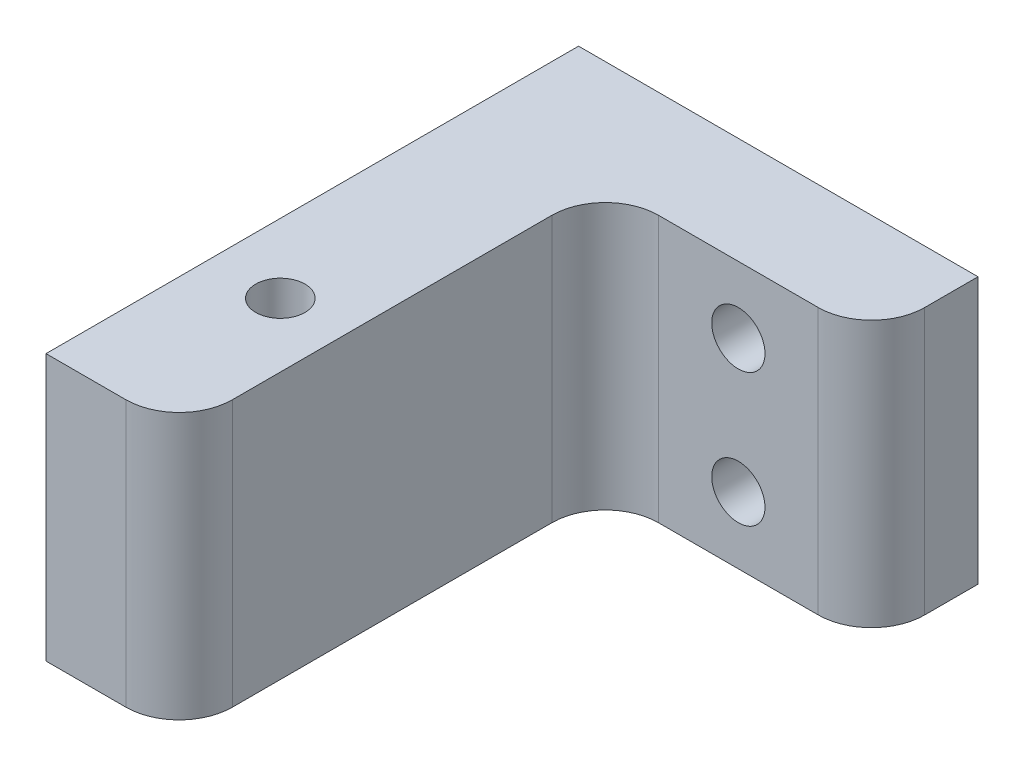
from build123d import *

# Parameters (mm, degrees)
SKETCH2_W           = 12.4
SKETCH2_H           = 10
SKETCH2_W_2         = 7.6
BOSS_EXTRUDE1_DEPTH = 5
SKETCH3_R           = 0.925
CUT_EXTRUDE1_DEPTH  = 10
SKETCH4_W           = 4
SKETCH4_H           = 10
BOSS_EXTRUDE2_DEPTH = 10
FILLET1_R           = 2
SKETCH5_R           = 1
CUT_EXTRUDE2_DEPTH  = 4


with BuildPart() as part:
    # Sketch2 → Boss-Extrude1 (new body)
    with BuildSketch(Plane(origin=(-29.355490461, 0, 0), x_dir=(0, 0, -1), z_dir=(1, 0, 0))):
        with Locations((6.2, -11)):
            Rectangle(SKETCH2_W, SKETCH2_H)
        with Locations((16.2, -11)):
            Rectangle(SKETCH2_W_2, SKETCH2_H)
    extrude(amount=BOSS_EXTRUDE1_DEPTH)

    # Sketch3 → Cut-Extrude1 (cut)
    with BuildSketch(Plane(origin=(0, -16, 0), x_dir=(-1, 0, 0), z_dir=(0, -1, 0))):
        with Locations(Location((26.755490461, 6.2, 0), (0, 0, 90))):
            Circle(SKETCH3_R)
    extrude(amount=-CUT_EXTRUDE1_DEPTH, mode=Mode.SUBTRACT)

    # Sketch4 → Boss-Extrude2 (add)
    with BuildSketch(Plane(origin=(-24.355490461, 0, 0), x_dir=(0, 0, -1), z_dir=(1, 0, 0))):
        with Locations((18, -11)):
            Rectangle(SKETCH4_W, SKETCH4_H)
    extrude(amount=BOSS_EXTRUDE2_DEPTH)

    # Fillet1
    fillet1_edges = [part.edges().sort_by_distance(p)[0] for p in [
        (-24.355490461, -11, 0),
        (-24.355490461, -11, -16),
        (-14.355490461, -11, -16),
    ]]
    fillet(fillet1_edges, radius=FILLET1_R)

    # Sketch5 → Cut-Extrude2 (cut)
    with BuildSketch(Plane.XY.offset(-16)):
        with Locations((-19.355490461, -8.5)):
            Circle(SKETCH5_R)
        with Locations((-19.355490461, -13.5)):
            Circle(SKETCH5_R)
    extrude(amount=-CUT_EXTRUDE2_DEPTH, mode=Mode.SUBTRACT)


solid = part.part
